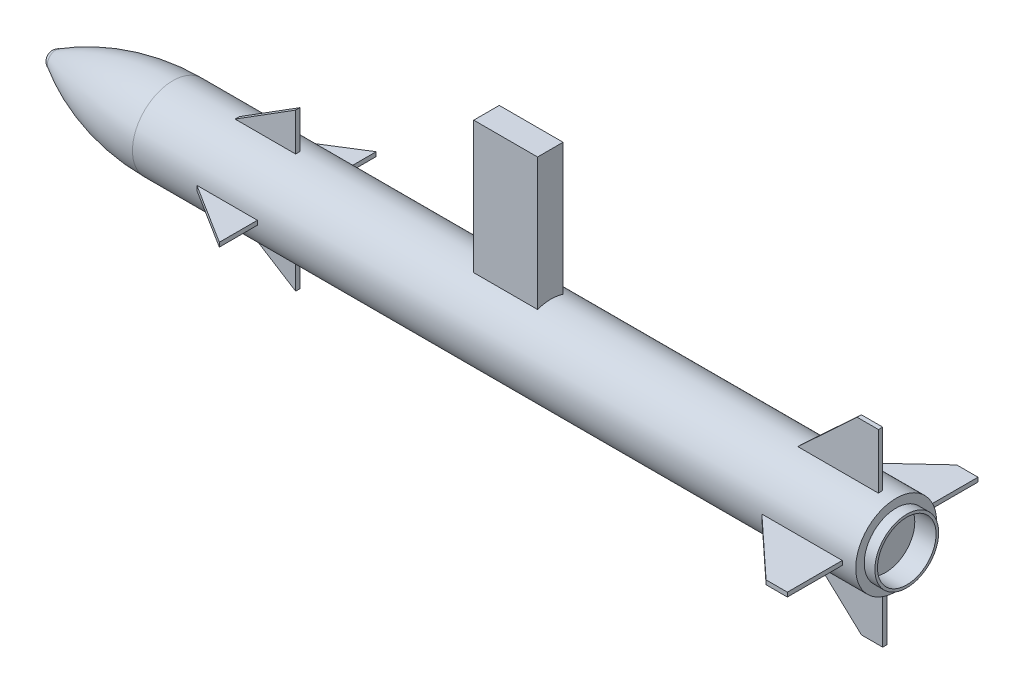
from build123d import *

# Parameters (mm, degrees)
D_ME1_FACE_RADIUS            = 400
D_ME1_HEIGHT                 = 290
ESQUISSE2_R                  = 1377.564968988
ENL_V_MAT_EXTRU_1_DEPTH      = 1000
BOSS_EXTRU_1_DEPTH           = 200
R_P_TITION_CIRCULAIRE1_COUNT = 4
BOSS_EXTRU_2_DEPTH           = 100
R_P_TITION_CIRCULAIRE2_COUNT = 4
ESQUISSE6_W                  = 3000
ESQUISSE6_H                  = 1200
BOSS_EXTRU_3_DEPTH           = 8000
ECHELLE1_SCALE               = 0.05


with BuildPart() as part:
    # Esquisse1 → Révolution1 (revolve)
    with BuildSketch(Plane(origin=(0, 0, 0), x_dir=(1, 0, 0), z_dir=(0, 1, 0))):
        with BuildLine():
            Line((0, 0), (0, 400))
            ThreePointArc((0, 400), (2649.561437252, 1518.274730075), (5500, 1900))
            Line((5500, 1900), (39500, 1900))
            Line((39500, 1900), (39500, 1500))
            Line((39500, 1500), (40000, 1500))
            Line((40000, 1500), (40000, 0))
            Line((40000, 0), (0, 0))
        make_face()
    revolve(axis=Axis((40000, 0, 0), (-1, 0, 0)))

    # Dôme1: a dome of height H over a round flat face of radius A is a cap of a sphere of radius (A * A + H * H) / (2 * H)
    d_me1_r = (D_ME1_FACE_RADIUS * D_ME1_FACE_RADIUS + D_ME1_HEIGHT * D_ME1_HEIGHT) / (2 * D_ME1_HEIGHT)
    d_me1_base = Plane((0, 0, 0), z_dir=(-1, 0, 0))
    with Locations(d_me1_base.offset(D_ME1_HEIGHT - d_me1_r)):
        d_me1_ball = Sphere(d_me1_r, mode=Mode.PRIVATE)
    add(split(d_me1_ball, bisect_by=d_me1_base, keep=Keep.TOP, mode=Mode.PRIVATE))

    # Esquisse2 → Enlèv. mat.-Extru.1 (cut)
    with BuildSketch(Plane(origin=(40000, 0, 0), x_dir=(0, 0, -1), z_dir=(1, 0, 0))):
        Circle(ESQUISSE2_R)
    extrude(amount=-ENL_V_MAT_EXTRU_1_DEPTH, mode=Mode.SUBTRACT)

    # Esquisse3 → Boss.-Extru.1 (add)
    with BuildSketch(Plane.XY):
        Polygon((38867.882175008, 1693.755150427), (38867.882175008, 4480.75805387), (37867.882175008, 4480.75805387), (34867.882175008, 1693.755150427), align=None)
    boss_extru_1 = extrude(amount=BOSS_EXTRU_1_DEPTH)

    # Répétition circulaire1: Boss.-Extru.1 ×4 about axis
    r_p_tition_circulaire1_axis = Axis((0, 0, 0), (1, 0, 0))
    for i in range(1, R_P_TITION_CIRCULAIRE1_COUNT):
        add(boss_extru_1.rotate(r_p_tition_circulaire1_axis, i * 360 / R_P_TITION_CIRCULAIRE1_COUNT))

    # Esquisse4 → Boss.-Extru.2 (add, symmetric)
    with BuildSketch(Plane.XY):
        Polygon((8155.279549148, 1665.288677311), (11371.991011305, 3686.408268577), (11371.991011305, 1665.288677311), align=None)
    boss_extru_2 = extrude(amount=BOSS_EXTRU_2_DEPTH, both=True)

    # Répétition circulaire2: Boss.-Extru.2 ×4 about axis
    r_p_tition_circulaire2_axis = Axis((0, 0, 0), (1, 0, 0))
    for i in range(1, R_P_TITION_CIRCULAIRE2_COUNT):
        add(boss_extru_2.rotate(r_p_tition_circulaire2_axis, i * 360 / R_P_TITION_CIRCULAIRE2_COUNT))

    # Esquisse6 → Boss.-Extru.3 (add)
    with BuildSketch(Plane(origin=(0, 0, 0), x_dir=(1, 0, 0), z_dir=(0, 1, 0))):
        with Locations((21779.89327035, -36.087335649)):
            Rectangle(ESQUISSE6_W, ESQUISSE6_H)
    extrude(amount=BOSS_EXTRU_3_DEPTH)


with BuildPart() as part_1:
    # Echelle1: scaled about (20884.167787821, 241.899239244, 1.78815963)
    add(part.part.scale(ECHELLE1_SCALE).moved(Location((19839.95939843, 229.804277282, 1.698751648))))


solid = part_1.part
